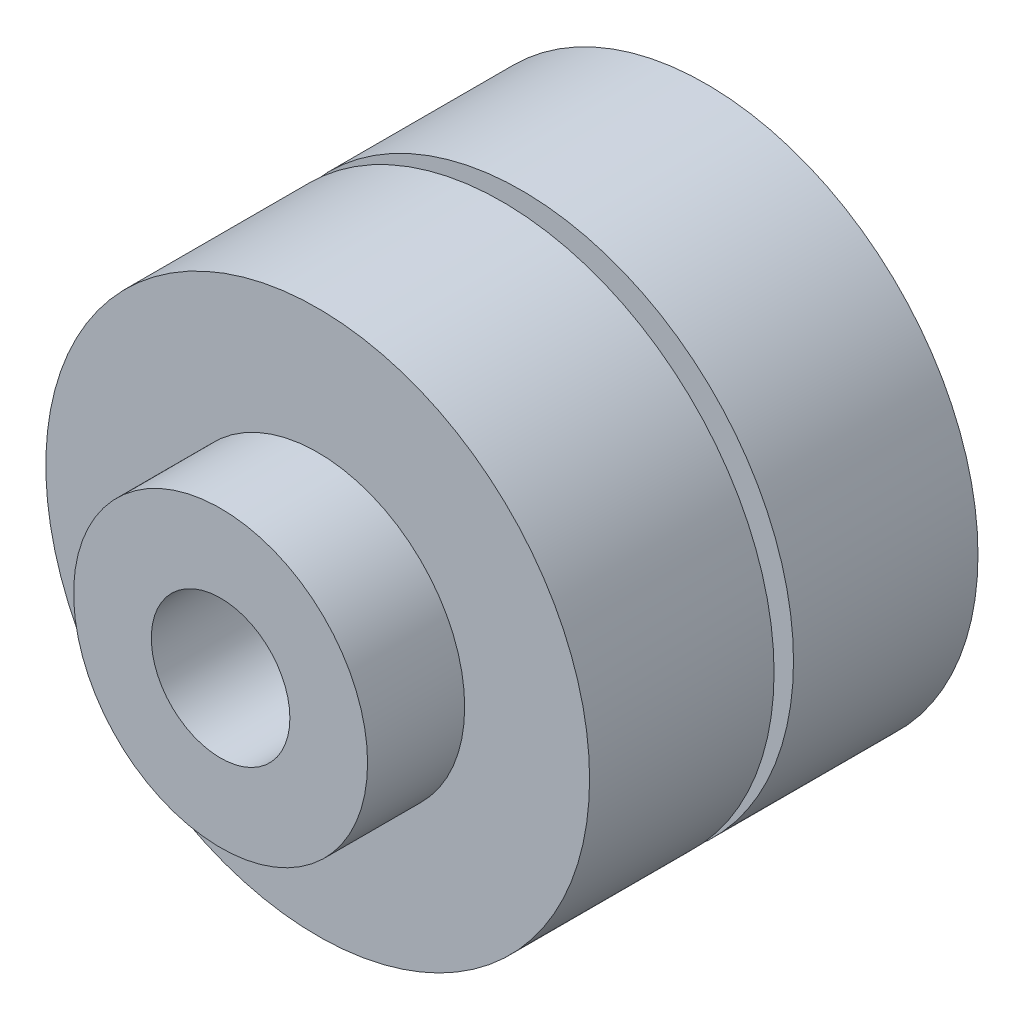
from build123d import *


with BuildPart() as part:
    # Sketch1 → Revolve1 (revolve)
    with BuildSketch(Plane(origin=(0, 0, 0), x_dir=(1, 0, 0), z_dir=(0, 1, 0)), mode=Mode.PRIVATE) as revolve1_sk:
        Polygon((-5, 60), (-5, 30), (-50, 30), (-50, -30), (-17.841241162, -30), (-17.841241162, -75), (-37.841241162, -75), (-37.841241162, -50), (-70, -50), (-70, -2.5), (-55, -2.5), (-55, 2.5), (-70, 2.5), (-70, 50), (-25, 50), (-25, 60), align=None)
    revolve(revolve1_sk.sketch.rotate(Axis((0, 0, 16.413049125), (0, 0, -1)), 180), axis=Axis((0, 0, 16.413049125), (0, 0, -1)))


solid = part.part
